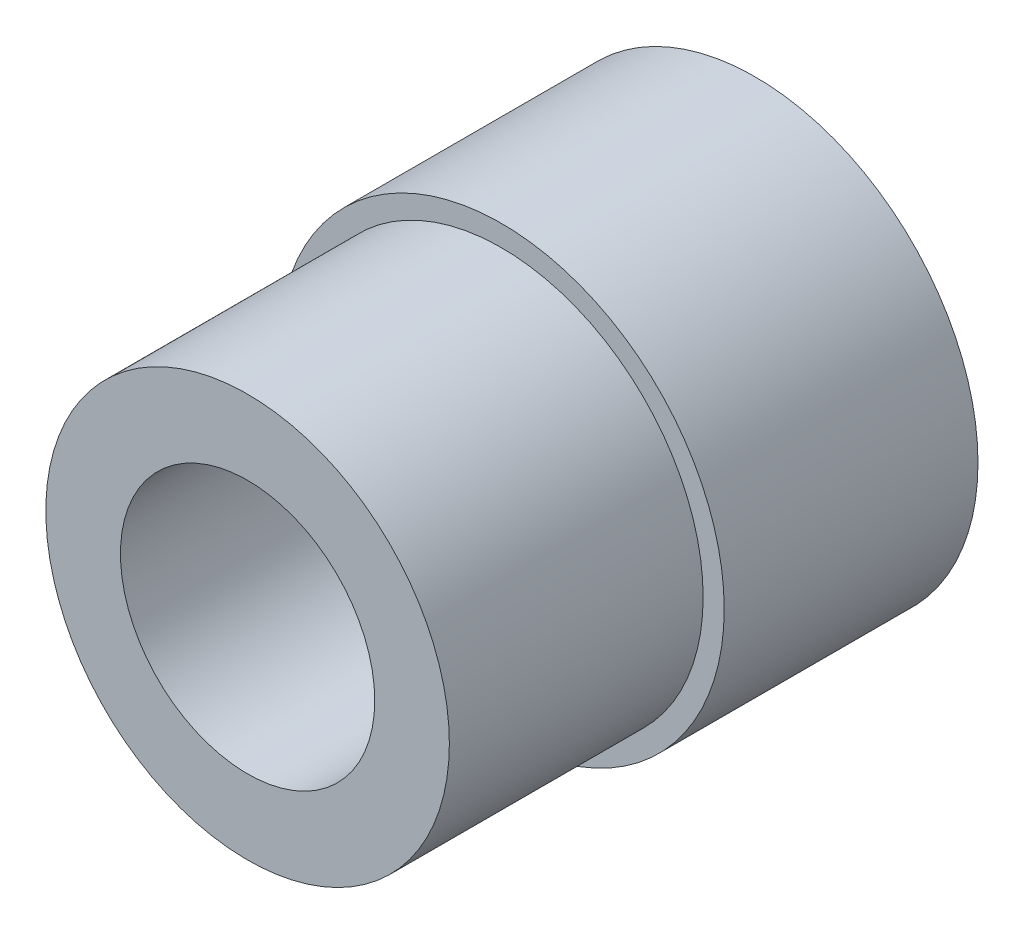
from build123d import *

# Parameters (mm, degrees)
SKETCH1_R          = 11.1506
SKETCH1_R_2        = 6.3627
EXTRUDE1_DEPTH     = 12.7
SKETCH5_R          = 11.1506
SKETCH5_R_2        = 10.0965
CUT_EXTRUDE1_DEPTH = 12.7


with BuildPart() as part:
    # Sketch1 → Extrude1 (new, symmetric)
    with BuildSketch(Plane.XY):
        Circle(SKETCH1_R)
        Circle(SKETCH1_R_2, mode=Mode.SUBTRACT)
    extrude(amount=EXTRUDE1_DEPTH, both=True)

    # Sketch5 → Cut-Extrude1 (cut)
    with BuildSketch(Plane.XY.offset(12.7)):
        Circle(SKETCH5_R)
        Circle(SKETCH5_R_2, mode=Mode.SUBTRACT)
    extrude(amount=-CUT_EXTRUDE1_DEPTH, mode=Mode.SUBTRACT)


solid = part.part
